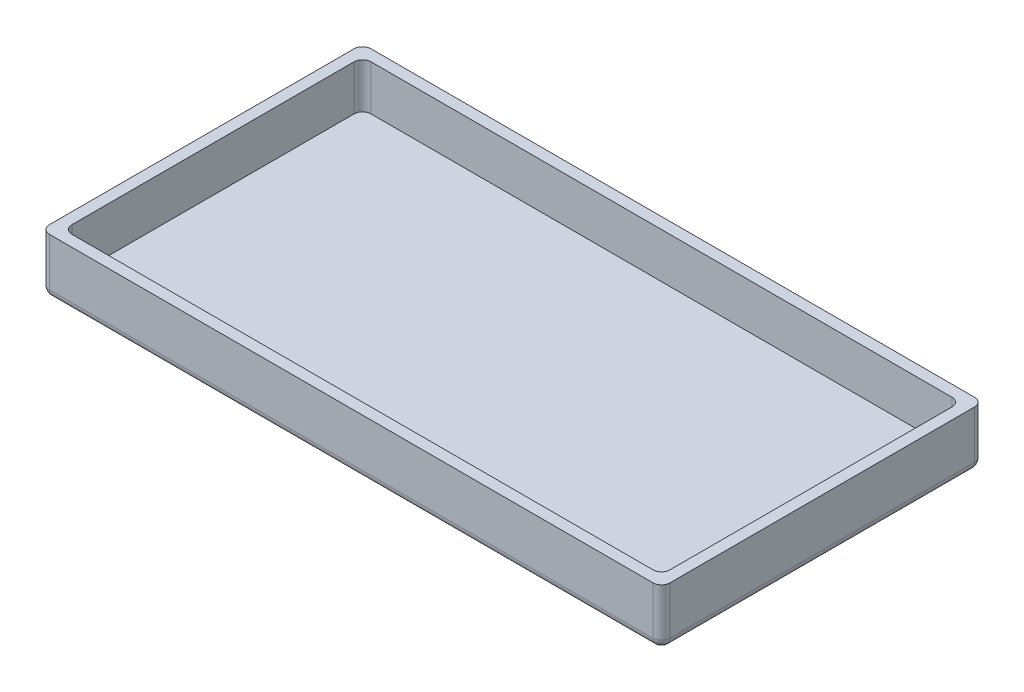
from build123d import *

# Parameters (mm, degrees)
SKETCH1_W           = 110
SKETCH1_H           = 57
SKETCH1_W_2         = 106
SKETCH1_H_2         = 53
EXTRUDE_THIN1_DEPTH = 10
SKETCH2_W           = 110
SKETCH2_H           = 57
BOSS_EXTRUDE1_DEPTH = 2
FILLET1_R           = 1.5
SKETCH4_W           = 0.628205129
SKETCH4_H           = 3.5
SKETCH4_W_2         = 1.211538462
SKETCH4_H_2         = 0.583333334
SKETCH4_W_3         = 0.628205128
CUT_EXTRUDE1_DEPTH  = 0.75


with BuildPart() as part:
    # Sketch1 → Extrude-Thin1 (new body)
    with BuildSketch(Plane(origin=(0, 0, 0), x_dir=(1, 0, 0), z_dir=(0, 1, 0))):
        Rectangle(SKETCH1_W, SKETCH1_H)
        Rectangle(SKETCH1_W_2, SKETCH1_H_2, mode=Mode.SUBTRACT)
    extrude(amount=EXTRUDE_THIN1_DEPTH)

    # Sketch2 → Boss-Extrude1 (add)
    with BuildSketch(Plane(origin=(0, 0, 0), x_dir=(1, 0, 0), z_dir=(0, 1, 0))):
        Rectangle(SKETCH2_W, SKETCH2_H)
    extrude(amount=BOSS_EXTRUDE1_DEPTH)

    # Fillet1
    fillet1_edges = [part.edges().sort_by_distance(p)[0] for p in [
        (53, 6, 26.5),
        (53, 6, -26.5),
        (-53, 6, -26.5),
        (-53, 6, 26.5),
        (0, 0, 28.5),
        (-55, 0, 0),
        (0, 0, -28.5),
        (55, 0, 0),
        (55, 5, 28.5),
        (-55, 5, 28.5),
        (-55, 5, -28.5),
        (55, 5, -28.5),
    ]]
    fillet(fillet1_edges, radius=FILLET1_R)

    # Sketch4 → Cut-Extrude1 (cut)
    # profile 1 of 12: a face of its own
    with BuildSketch(Plane(origin=(0, 0, 0), x_dir=(-1, 0, 0), z_dir=(0, -1, 0))):
        with BuildLine():
            Line((-15.013259857, 0.325934051), (-15.013259857, 3.825934051))
            Line((-15.013259857, 3.825934051), (-14.452362421, 3.825934051))
            add(Edge.make_bspline(
                [(-14.452362421, 3.825934051), (-14.413096093, 3.825938532), (-14.337116494, 3.825947204), (-14.22749776, 3.822097754), (-14.125835643, 3.817118059), (-14.032453669, 3.811546938), (-13.947192897, 3.801946784), (-13.870182979, 3.791829271), (-13.80127005, 3.779628173), (-13.75866493, 3.768683411), (-13.738620434, 3.763534211)],
                knots=[0, 0, 0, 0, 1.311965854, 2.538629056, 3.664479157, 4.713267157, 5.663616078, 6.530575999, 7.308677837, 8, 8, 8, 8], degree=3))
            add(Edge.make_bspline(
                [(-13.738620434, 3.763534211), (-13.712299975, 3.756271174), (-13.660650786, 3.742018763), (-13.586672665, 3.713235404), (-13.516494098, 3.681240659), (-13.450200771, 3.64474064), (-13.388199751, 3.603294687), (-13.330726663, 3.556573875), (-13.276541956, 3.506453574), (-13.227569604, 3.451536945), (-13.183306667, 3.393507355), (-13.14485011, 3.332380007), (-13.111436292, 3.26908958), (-13.084696484, 3.202839605), (-13.064548542, 3.133935181), (-13.049812421, 3.062670541), (-13.040261419, 2.988820186), (-13.039358975, 2.938577376), (-13.038900882, 2.913073474)],
                knots=[0, 0, 0, 0, 1.099996261, 2.158545794, 3.195537121, 4.207578794, 5.205712374, 6.197378256, 7.190519799, 8.17788031, 9.159561366, 10.129234751, 11.085776129, 12.040971148, 13.00380137, 13.975669004, 14.972423361, 16, 16, 16, 16], degree=3))
            add(Edge.make_bspline(
                [(-13.038900882, 2.913073474), (-13.040098658, 2.880307655), (-13.042456333, 2.815812166), (-13.057517317, 2.721079962), (-13.085759009, 2.631544413), (-13.122712576, 2.545555412), (-13.172957874, 2.463433699), (-13.236759684, 2.385218322), (-13.313084628, 2.30850091), (-13.371630073, 2.262513997), (-13.402081972, 2.238594308)],
                knots=[0, 0, 0, 0, 0.986156485, 1.941127874, 2.875419072, 3.804401753, 4.751181392, 5.761612777, 6.835722519, 8, 8, 8, 8], degree=3))
            add(Edge.make_bspline(
                [(-13.402081972, 2.238594308), (-13.377405214, 2.225997036), (-13.329020917, 2.201297273), (-13.260329431, 2.160698234), (-13.196728613, 2.117516008), (-13.137933296, 2.072619438), (-13.08517678, 2.024105292), (-13.036280659, 1.974769024), (-12.993657215, 1.921783869), (-12.955542046, 1.86703832), (-12.922412961, 1.809739655), (-12.893561181, 1.749984638), (-12.869191117, 1.687569133), (-12.848553917, 1.622810784), (-12.833162688, 1.555486853), (-12.823127279, 1.485573263), (-12.815443542, 1.413308454), (-12.81484582, 1.36408347), (-12.814541908, 1.339055045)],
                knots=[0, 0, 0, 0, 1.164658916, 2.283573913, 3.35186032, 4.395461096, 5.390182219, 6.362969632, 7.312859996, 8.245001507, 9.165155236, 10.092416118, 11.032087915, 11.979892451, 12.947605196, 13.931445124, 14.948243989, 16, 16, 16, 16], degree=3))
            add(Edge.make_bspline(
                [(-12.814541908, 1.339055045), (-12.816514092, 1.291252183), (-12.82040619, 1.196913426), (-12.848863311, 1.058402464), (-12.898198916, 0.92708151), (-12.964446461, 0.803472488), (-13.046076182, 0.691153678), (-13.139926952, 0.592763375), (-13.24505391, 0.509478167), (-13.342046235, 0.453267114), (-13.425936958, 0.41554424), (-13.495422076, 0.392221581), (-13.57004762, 0.370615504), (-13.651180551, 0.355443272), (-13.737350039, 0.341555976), (-13.829396242, 0.332981672), (-13.927147128, 0.327171077), (-13.994286662, 0.326354729), (-14.028884857, 0.325934051)],
                knots=[0, 0, 0, 0, 1.284142165, 2.534249414, 3.780121997, 5.041676246, 6.291546858, 7.49970053, 8.684500223, 9.883330709, 10.50184324, 11.153274765, 11.851151195, 12.587658647, 13.369265475, 14.195992086, 15.070362669, 16, 16, 16, 16], degree=3))
            Line((-14.028884857, 0.325934051), (-15.013259857, 0.325934051))
        make_face()
        with BuildLine():
            Line((-14.385054729, 3.197728923), (-14.385054729, 2.43490841))
            Line((-14.385054729, 2.43490841), (-14.218187741, 2.43490841))
            add(Edge.make_bspline(
                [(-14.218187741, 2.43490841), (-14.195509019, 2.435106177), (-14.151729117, 2.435487954), (-14.088493692, 2.440405114), (-14.02969496, 2.448794093), (-13.97555593, 2.460498829), (-13.925572278, 2.475362137), (-13.880063315, 2.493245897), (-13.839229134, 2.515066029), (-13.79178926, 2.547568079), (-13.741641892, 2.595396299), (-13.697497728, 2.664494074), (-13.67149711, 2.743956251), (-13.668601343, 2.799999132), (-13.667106011, 2.828938859)],
                knots=[0, 0, 0, 0, 1.065314748, 2.056525647, 2.977365736, 3.853934255, 4.656397591, 5.425096493, 6.14721249, 6.826394842, 8.123232004, 9.372140726, 10.643011755, 12, 12, 12, 12], degree=3))
            add(Edge.make_bspline(
                [(-13.667106011, 2.828938859), (-13.66830255, 2.856045721), (-13.670616011, 2.908455751), (-13.69679529, 2.9820441), (-13.737456886, 3.047258438), (-13.785463616, 3.09189232), (-13.83067128, 3.122375945), (-13.869380856, 3.142448114), (-13.911867522, 3.160416514), (-13.958953776, 3.174155591), (-14.010370728, 3.184464911), (-14.065868617, 3.192035871), (-14.125543197, 3.197188989), (-14.166760556, 3.197545084), (-14.188039504, 3.197728923)],
                knots=[0, 0, 0, 0, 1.347982417, 2.606269829, 3.849316587, 5.153353503, 5.842674298, 6.568177932, 7.326619318, 8.142485038, 9.012069166, 9.942760135, 10.937925643, 12, 12, 12, 12], degree=3))
            Line((-14.188039504, 3.197728923), (-14.385054729, 3.197728923))
        make_face(mode=Mode.SUBTRACT)
        with BuildLine():
            Line((-14.385054729, 1.851575077), (-14.385054729, 0.954139179))
            Line((-14.385054729, 0.954139179), (-14.204165306, 0.954139179))
            add(Edge.make_bspline(
                [(-14.204165306, 0.954139179), (-14.168403236, 0.954343487), (-14.099646196, 0.954736293), (-14.001151857, 0.959482329), (-13.911595879, 0.968036222), (-13.831215552, 0.978715068), (-13.759887758, 0.993183235), (-13.697853603, 1.011577654), (-13.644262367, 1.03181472), (-13.599435387, 1.056809898), (-13.562814313, 1.085898088), (-13.529767633, 1.115626916), (-13.502823429, 1.149921928), (-13.481504672, 1.187310935), (-13.463053326, 1.226865165), (-13.451924776, 1.270129198), (-13.44345189, 1.315820791), (-13.442985604, 1.347424678), (-13.442747036, 1.363594308)],
                knots=[0, 0, 0, 0, 1.753078804, 3.370512758, 4.83203934, 6.162291463, 7.344201807, 8.395507345, 9.331626367, 10.147333109, 10.898971645, 11.62040215, 12.321813352, 13.025280112, 13.727906689, 14.453419512, 15.208716525, 16, 16, 16, 16], degree=3))
            add(Edge.make_bspline(
                [(-13.442747036, 1.363594308), (-13.443273147, 1.382084533), (-13.444297868, 1.418098519), (-13.452666778, 1.470736802), (-13.467875821, 1.519878132), (-13.487032353, 1.566779119), (-13.513689685, 1.609760544), (-13.545371014, 1.650309831), (-13.583650146, 1.687053856), (-13.626697264, 1.722215036), (-13.676907465, 1.753000554), (-13.734304306, 1.779712443), (-13.799199598, 1.80202123), (-13.871794362, 1.8197835), (-13.951770347, 1.834858094), (-14.03971129, 1.84385929), (-14.134884789, 1.850553875), (-14.200879642, 1.851226942), (-14.235014665, 1.851575077)],
                knots=[0, 0, 0, 0, 0.845221588, 1.646264278, 2.427170338, 3.19324141, 3.95557735, 4.731569926, 5.540061037, 6.376114724, 7.268642756, 8.224665384, 9.265483498, 10.400594375, 11.639216012, 12.983232105, 14.439614077, 16, 16, 16, 16], degree=3))
            Line((-14.235014665, 1.851575077), (-14.385054729, 1.851575077))
        make_face(mode=Mode.SUBTRACT)
    # profile 2 of 12: a face of its own
    with BuildSketch(Plane(origin=(0, 0, 0), x_dir=(-1, 0, 0), z_dir=(0, -1, 0))):
        with Locations((-11.961977806, 2.075934051)):
            Rectangle(SKETCH4_W, SKETCH4_H)
    # profile 3 of 12: a face of its own
    with BuildSketch(Plane(origin=(0, 0, 0), x_dir=(-1, 0, 0), z_dir=(0, -1, 0))):
        with BuildLine():
            Line((-7.699157293, 3.218762577), (-8.159794312, 2.77845809))
            add(Edge.make_bspline(
                [(-8.159794312, 2.77845809), (-8.198869297, 2.818861689), (-8.275194984, 2.897782577), (-8.398184388, 3.002266878), (-8.526088892, 3.089340406), (-8.656420366, 3.162673176), (-8.791523097, 3.218154644), (-8.929834929, 3.258584923), (-9.072239025, 3.283233737), (-9.168612639, 3.286053997), (-9.217085979, 3.287472513)],
                knots=[0, 0, 0, 0, 1.115251505, 2.178435587, 3.19620269, 4.182487026, 5.141301733, 6.088180966, 7.038406374, 8, 8, 8, 8], degree=3))
            add(Edge.make_bspline(
                [(-9.217085979, 3.287472513), (-9.257567108, 3.286351836), (-9.337452156, 3.284140304), (-9.454744341, 3.267927594), (-9.566940378, 3.240357175), (-9.674424331, 3.20236003), (-9.776879925, 3.153193741), (-9.87452197, 3.092896362), (-9.967109734, 3.022012464), (-10.053420185, 2.940908803), (-10.132373954, 2.852296959), (-10.202134635, 2.757748332), (-10.260570396, 2.657479529), (-10.308527675, 2.552505998), (-10.345884541, 2.442341869), (-10.372562037, 2.327061311), (-10.387991587, 2.206527031), (-10.390294551, 2.124588726), (-10.391464985, 2.082945269)],
                knots=[0, 0, 0, 0, 1.035432265, 2.043311493, 3.022114605, 3.98653278, 4.95457646, 5.923598177, 6.917315552, 7.932509744, 8.948865224, 9.949768934, 10.933144597, 11.912367597, 12.897413939, 13.903909035, 14.934704909, 16, 16, 16, 16], degree=3))
            add(Edge.make_bspline(
                [(-10.391464985, 2.082945269), (-10.391127679, 2.053716977), (-10.390462843, 1.996107413), (-10.383185031, 1.91088688), (-10.371466039, 1.828202815), (-10.354505754, 1.748180463), (-10.33329675, 1.670750477), (-10.30841376, 1.595244871), (-10.277198414, 1.522706963), (-10.24254891, 1.452294273), (-10.202251936, 1.385928098), (-10.158804363, 1.322642442), (-10.111692565, 1.262747526), (-10.060611394, 1.206488201), (-10.004841947, 1.154743675), (-9.945825658, 1.105957928), (-9.882567004, 1.061352233), (-9.816380026, 1.019807161), (-9.746692955, 0.983716603), (-9.67539656, 0.95102553), (-9.601409845, 0.924475518), (-9.525633643, 0.903073786), (-9.448338751, 0.88487481), (-9.368769154, 0.873669141), (-9.28761462, 0.865183219), (-9.232767777, 0.864659263), (-9.205166908, 0.86439559)],
                knots=[0, 0, 0, 0, 1.103660481, 2.175337485, 3.227646561, 4.255952547, 5.262355991, 6.258840057, 7.255597736, 8.242457506, 9.22035537, 10.185017736, 11.140346927, 12.096287581, 13.051739095, 14.01125915, 14.986044842, 15.97314143, 16.960198552, 17.947847494, 18.933482797, 19.925264591, 20.920966487, 21.929612487, 22.958107872, 24, 24, 24, 24], degree=3))
            add(Edge.make_bspline(
                [(-9.205166908, 0.86439559), (-9.158351091, 0.865749751), (-9.066370185, 0.868410327), (-8.931374979, 0.889215654), (-8.802737997, 0.92343924), (-8.699957664, 0.963855306), (-8.619431987, 1.003766696), (-8.55812898, 1.040682766), (-8.494736893, 1.081977444), (-8.430308614, 1.129209235), (-8.364119453, 1.181811338), (-8.297337801, 1.240935839), (-8.228254037, 1.304635853), (-8.182997947, 1.350099803), (-8.159794312, 1.373410013)],
                knots=[0, 0, 0, 0, 1.404581149, 2.759636711, 4.088442092, 5.392261763, 6.066678138, 6.783632037, 7.538459478, 8.336747902, 9.180226004, 10.074962426, 11.012997595, 12, 12, 12, 12], degree=3))
            Line((-8.159794312, 1.373410013), (-7.713179729, 0.904359532))
            add(Edge.make_bspline(
                [(-7.713179729, 0.904359532), (-7.74457433, 0.87404903), (-7.805849878, 0.814889412), (-7.89828234, 0.730888276), (-7.990598473, 0.655403916), (-8.08056811, 0.585696583), (-8.169665049, 0.52379702), (-8.25787984, 0.469643406), (-8.344213854, 0.421866119), (-8.430459843, 0.3812709), (-8.517154476, 0.346801342), (-8.606353065, 0.317125316), (-8.698328299, 0.292020465), (-8.793641921, 0.271764147), (-8.891404902, 0.255521315), (-8.992532176, 0.244557498), (-9.096382544, 0.237186888), (-9.166825858, 0.236524577), (-9.202362421, 0.236190461)],
                knots=[0, 0, 0, 0, 1.244526981, 2.429050516, 3.560637417, 4.644440555, 5.67424972, 6.652764056, 7.595344123, 8.486817594, 9.369275933, 10.254498637, 11.166417451, 12.086725134, 13.032340136, 13.991389299, 14.986715468, 16, 16, 16, 16], degree=3))
            add(Edge.make_bspline(
                [(-9.202362421, 0.236190461), (-9.267638685, 0.237854484), (-9.395366189, 0.241110512), (-9.582547515, 0.265235481), (-9.760364751, 0.305680567), (-9.929250492, 0.362881073), (-10.089151036, 0.435952039), (-10.240025477, 0.525533612), (-10.381630637, 0.631387788), (-10.512822626, 0.752273854), (-10.631492024, 0.885782365), (-10.736382029, 1.029133879), (-10.823147045, 1.183032917), (-10.895189907, 1.345205897), (-10.951526478, 1.516392879), (-10.991177874, 1.696779034), (-11.0156306, 1.886190188), (-11.018305763, 2.015562372), (-11.019670113, 2.081543025)],
                knots=[0, 0, 0, 0, 1.078019885, 2.10938526, 3.111377082, 4.085535484, 5.04941344, 6.010039228, 6.978205633, 7.964457913, 8.951525778, 9.924444315, 10.892603023, 11.863865945, 12.85144698, 13.863884204, 14.910567087, 16, 16, 16, 16], degree=3))
            add(Edge.make_bspline(
                [(-11.019670113, 2.081543025), (-11.019093605, 2.124575045), (-11.017951106, 2.209853989), (-11.005943339, 2.335476784), (-10.989203813, 2.457936538), (-10.962648077, 2.575961714), (-10.930637757, 2.691142328), (-10.890828718, 2.802226502), (-10.843284541, 2.909533503), (-10.789537686, 3.013242968), (-10.728734408, 3.112675491), (-10.66081047, 3.206976789), (-10.587514501, 3.29687485), (-10.507085318, 3.38117701), (-10.420691662, 3.460623458), (-10.327943476, 3.534783659), (-10.229398594, 3.604721154), (-10.12479029, 3.668632424), (-10.016150827, 3.726443565), (-9.904850433, 3.777435461), (-9.791162561, 3.820052943), (-9.675567893, 3.855402572), (-9.557578043, 3.88178857), (-9.438035193, 3.90176192), (-9.315922177, 3.91292715), (-9.233933865, 3.91475497), (-9.192546716, 3.915677641)],
                knots=[0, 0, 0, 0, 1.071919942, 2.124283339, 3.142214191, 4.149696895, 5.136002878, 6.119640489, 7.086990633, 8.058538607, 9.028339693, 9.988281803, 10.952401235, 11.916291999, 12.888973767, 13.874849856, 14.873389453, 15.898127285, 16.927174885, 17.938320013, 18.946391617, 19.950418109, 20.947802303, 21.956882652, 22.968648068, 24, 24, 24, 24], degree=3))
            add(Edge.make_bspline(
                [(-9.192546716, 3.915677641), (-9.157239234, 3.915148743), (-9.086991369, 3.914096446), (-8.98238051, 3.905324405), (-8.878606279, 3.891548004), (-8.776040221, 3.870762349), (-8.673948678, 3.84608715), (-8.573673247, 3.81377838), (-8.47363203, 3.777764168), (-8.375394023, 3.73471653), (-8.278822101, 3.687726146), (-8.186178614, 3.634413848), (-8.095908086, 3.578060416), (-8.010010858, 3.515330607), (-7.926877889, 3.448499748), (-7.84694389, 3.377256036), (-7.770910327, 3.300411627), (-7.723195885, 3.246116517), (-7.699157293, 3.218762577)],
                knots=[0, 0, 0, 0, 0.996412454, 1.982464992, 2.961075852, 3.949442424, 4.934965278, 5.923860011, 6.921385422, 7.934793307, 8.949617135, 9.951082467, 10.950285876, 11.951772932, 12.951063433, 13.960125323, 14.972308753, 16, 16, 16, 16], degree=3))
        make_face()
    # profile 4 of 12: a face of its own
    with BuildSketch(Plane(origin=(0, 0, 0), x_dir=(-1, 0, 0), z_dir=(0, -1, 0))):
        Polygon((-7.362618831, 3.825934051), (-6.663600402, 3.825934051), (-6.038900882, 2.598269788), (-5.414201363, 3.825934051), (-4.715182934, 3.825934051), (-5.724798318, 1.841759372), (-5.724798318, 0.325934051), (-6.353003447, 0.325934051), (-6.353003447, 1.841759372), align=None)
    # profile 5 of 12: a face of its own
    with BuildSketch(Plane(origin=(0, 0, 0), x_dir=(-1, 0, 0), z_dir=(0, -1, 0))):
        with BuildLine():
            Line((-0.923516267, 3.218762577), (-1.384153286, 2.77845809))
            add(Edge.make_bspline(
                [(-1.384153286, 2.77845809), (-1.423228271, 2.818861689), (-1.499553958, 2.897782577), (-1.622543363, 3.002266878), (-1.750447866, 3.089340406), (-1.88077934, 3.162673176), (-2.015882071, 3.218154644), (-2.154193904, 3.258584923), (-2.296597999, 3.283233737), (-2.392971613, 3.286053997), (-2.441444953, 3.287472513)],
                knots=[0, 0, 0, 0, 1.115251505, 2.178435587, 3.19620269, 4.182487026, 5.141301733, 6.088180966, 7.038406374, 8, 8, 8, 8], degree=3))
            add(Edge.make_bspline(
                [(-2.441444953, 3.287472513), (-2.481926082, 3.286351836), (-2.561811131, 3.284140304), (-2.679103316, 3.267927594), (-2.791299352, 3.240357175), (-2.898783306, 3.20236003), (-3.001238899, 3.153193741), (-3.098880944, 3.092896362), (-3.191468708, 3.022012464), (-3.27777916, 2.940908803), (-3.356732928, 2.852296959), (-3.426493609, 2.757748332), (-3.48492937, 2.657479529), (-3.532886649, 2.552505998), (-3.570243515, 2.442341869), (-3.596921011, 2.327061311), (-3.612350562, 2.206527031), (-3.614653525, 2.124588726), (-3.615823959, 2.082945269)],
                knots=[0, 0, 0, 0, 1.035432265, 2.043311493, 3.022114605, 3.98653278, 4.95457646, 5.923598177, 6.917315552, 7.932509744, 8.948865224, 9.949768934, 10.933144597, 11.912367597, 12.897413939, 13.903909035, 14.934704909, 16, 16, 16, 16], degree=3))
            add(Edge.make_bspline(
                [(-3.615823959, 2.082945269), (-3.615486654, 2.053716977), (-3.614821817, 1.996107413), (-3.607544006, 1.91088688), (-3.595825014, 1.828202815), (-3.578864728, 1.748180463), (-3.557655725, 1.670750477), (-3.532772734, 1.595244871), (-3.501557389, 1.522706963), (-3.466907884, 1.452294273), (-3.42661091, 1.385928098), (-3.383163338, 1.322642442), (-3.336051539, 1.262747526), (-3.284970369, 1.206488201), (-3.229200922, 1.154743675), (-3.170184633, 1.105957928), (-3.106925978, 1.061352233), (-3.040739001, 1.019807161), (-2.971051929, 0.983716603), (-2.899755534, 0.95102553), (-2.825768819, 0.924475518), (-2.749992617, 0.903073786), (-2.672697726, 0.88487481), (-2.593128129, 0.873669141), (-2.511973595, 0.865183219), (-2.457126751, 0.864659263), (-2.429525882, 0.86439559)],
                knots=[0, 0, 0, 0, 1.103660481, 2.175337485, 3.227646561, 4.255952547, 5.262355991, 6.258840057, 7.255597736, 8.242457506, 9.22035537, 10.185017736, 11.140346927, 12.096287581, 13.051739095, 14.01125915, 14.986044842, 15.97314143, 16.960198552, 17.947847494, 18.933482797, 19.925264591, 20.920966487, 21.929612487, 22.958107872, 24, 24, 24, 24], degree=3))
            add(Edge.make_bspline(
                [(-2.429525882, 0.86439559), (-2.382710066, 0.865749751), (-2.290729159, 0.868410327), (-2.155733953, 0.889215654), (-2.027096971, 0.92343924), (-1.924316638, 0.963855306), (-1.843790962, 1.003766696), (-1.782487955, 1.040682766), (-1.719095868, 1.081977444), (-1.654667589, 1.129209235), (-1.588478428, 1.181811338), (-1.521696776, 1.240935839), (-1.452613011, 1.304635853), (-1.407356921, 1.350099803), (-1.384153286, 1.373410013)],
                knots=[0, 0, 0, 0, 1.404581149, 2.759636711, 4.088442092, 5.392261763, 6.066678138, 6.783632037, 7.538459478, 8.336747902, 9.180226004, 10.074962426, 11.012997595, 12, 12, 12, 12], degree=3))
            Line((-1.384153286, 1.373410013), (-0.937538703, 0.904359532))
            add(Edge.make_bspline(
                [(-0.937538703, 0.904359532), (-0.968933304, 0.87404903), (-1.030208852, 0.814889412), (-1.122641315, 0.730888276), (-1.214957447, 0.655403916), (-1.304927085, 0.585696583), (-1.394024023, 0.52379702), (-1.482238814, 0.469643406), (-1.568572828, 0.421866119), (-1.654818818, 0.3812709), (-1.741513451, 0.346801342), (-1.83071204, 0.317125316), (-1.922687274, 0.292020465), (-2.018000895, 0.271764147), (-2.115763877, 0.255521315), (-2.21689115, 0.244557498), (-2.320741519, 0.237186888), (-2.391184832, 0.236524577), (-2.426721395, 0.236190461)],
                knots=[0, 0, 0, 0, 1.244526981, 2.429050516, 3.560637417, 4.644440555, 5.67424972, 6.652764056, 7.595344123, 8.486817594, 9.369275933, 10.254498637, 11.166417451, 12.086725134, 13.032340136, 13.991389299, 14.986715468, 16, 16, 16, 16], degree=3))
            add(Edge.make_bspline(
                [(-2.426721395, 0.236190461), (-2.491997659, 0.237854484), (-2.619725163, 0.241110512), (-2.80690649, 0.265235481), (-2.984723726, 0.305680567), (-3.153609466, 0.362881073), (-3.313510011, 0.435952039), (-3.464384451, 0.525533612), (-3.605989611, 0.631387788), (-3.7371816, 0.752273854), (-3.855850998, 0.885782365), (-3.960741003, 1.029133879), (-4.047506019, 1.183032917), (-4.119548882, 1.345205897), (-4.175885453, 1.516392879), (-4.215536848, 1.696779034), (-4.239989574, 1.886190188), (-4.242664737, 2.015562372), (-4.244029088, 2.081543025)],
                knots=[0, 0, 0, 0, 1.078019885, 2.10938526, 3.111377082, 4.085535484, 5.04941344, 6.010039228, 6.978205633, 7.964457913, 8.951525778, 9.924444315, 10.892603023, 11.863865945, 12.85144698, 13.863884204, 14.910567087, 16, 16, 16, 16], degree=3))
            add(Edge.make_bspline(
                [(-4.244029088, 2.081543025), (-4.243452579, 2.124575045), (-4.24231008, 2.209853989), (-4.230302313, 2.335476784), (-4.213562787, 2.457936538), (-4.187007051, 2.575961714), (-4.154996731, 2.691142328), (-4.115187692, 2.802226502), (-4.067643515, 2.909533503), (-4.013896661, 3.013242968), (-3.953093382, 3.112675491), (-3.885169445, 3.206976789), (-3.811873476, 3.29687485), (-3.731444293, 3.38117701), (-3.645050637, 3.460623458), (-3.55230245, 3.534783659), (-3.453757568, 3.604721154), (-3.349149265, 3.668632424), (-3.240509801, 3.726443565), (-3.129209408, 3.777435461), (-3.015521535, 3.820052943), (-2.899926867, 3.855402572), (-2.781937018, 3.88178857), (-2.662394168, 3.90176192), (-2.540281151, 3.91292715), (-2.45829284, 3.91475497), (-2.41690569, 3.915677641)],
                knots=[0, 0, 0, 0, 1.071919942, 2.124283339, 3.142214191, 4.149696895, 5.136002878, 6.119640489, 7.086990633, 8.058538607, 9.028339693, 9.988281803, 10.952401235, 11.916291999, 12.888973767, 13.874849856, 14.873389453, 15.898127285, 16.927174885, 17.938320013, 18.946391617, 19.950418109, 20.947802303, 21.956882652, 22.968648068, 24, 24, 24, 24], degree=3))
            add(Edge.make_bspline(
                [(-2.41690569, 3.915677641), (-2.381598208, 3.915148743), (-2.311350343, 3.914096446), (-2.206739484, 3.905324405), (-2.102965254, 3.891548004), (-2.000399196, 3.870762349), (-1.898307653, 3.84608715), (-1.798032222, 3.81377838), (-1.697991004, 3.777764168), (-1.599752997, 3.73471653), (-1.503181076, 3.687726146), (-1.410537589, 3.634413848), (-1.320267061, 3.578060416), (-1.234369832, 3.515330607), (-1.151236864, 3.448499748), (-1.071302864, 3.377256036), (-0.995269301, 3.300411627), (-0.947554859, 3.246116517), (-0.923516267, 3.218762577)],
                knots=[0, 0, 0, 0, 0.996412454, 1.982464992, 2.961075852, 3.949442424, 4.934965278, 5.923860011, 6.921385422, 7.934793307, 8.949617135, 9.951082467, 10.950285876, 11.951772932, 12.951063433, 13.960125323, 14.972308753, 16, 16, 16, 16], degree=3))
        make_face()
    # profile 6 of 12: a face of its own
    with BuildSketch(Plane(origin=(0, 0, 0), x_dir=(-1, 0, 0), z_dir=(0, -1, 0))):
        Polygon((-0.295311139, 3.825934051), (0.332893989, 3.825934051), (0.332893989, 0.954139179), (1.320073477, 0.954139179), (1.320073477, 0.325934051), (-0.295311139, 0.325934051), align=None)
    # profile 7 of 12: a face of its own
    with BuildSketch(Plane(origin=(0, 0, 0), x_dir=(-1, 0, 0), z_dir=(0, -1, 0))):
        Polygon((1.858535015, 3.825934051), (3.7431504, 3.825934051), (3.7431504, 3.197728923), (2.486740143, 3.197728923), (2.486740143, 2.524652), (3.7431504, 2.524652), (3.7431504, 1.896446872), (2.486740143, 1.896446872), (2.486740143, 0.954139179), (3.7431504, 0.954139179), (3.7431504, 0.325934051), (1.858535015, 0.325934051), align=None)
    # profile 8 of 12: a face of its own
    with BuildSketch(Plane(origin=(0, 0, 0), x_dir=(-1, 0, 0), z_dir=(0, -1, 0))):
        with BuildLine():
            Line((8.183354727, 1.447728923), (6.166227323, 1.447728923))
            add(Edge.make_bspline(
                [(6.166227323, 1.447728923), (6.170340083, 1.424291047), (6.17842198, 1.378233771), (6.195972108, 1.311331582), (6.218368704, 1.248284088), (6.245209613, 1.18900701), (6.276042299, 1.133186974), (6.312006073, 1.081085797), (6.352644766, 1.032749499), (6.397723417, 0.988388154), (6.446490647, 0.948639428), (6.498709953, 0.913817031), (6.554435222, 0.885264796), (6.613027584, 0.861198224), (6.674924859, 0.842135061), (6.740218144, 0.828987561), (6.808734358, 0.821221284), (6.855409695, 0.820097981), (6.879268188, 0.819523795)],
                knots=[0, 0, 0, 0, 1.091296461, 2.144483647, 3.168565212, 4.157007626, 5.126487748, 6.090021542, 7.05641414, 8.019231907, 8.98705074, 9.938580405, 10.892824166, 11.854447369, 12.841318655, 13.858982407, 14.905600794, 16, 16, 16, 16], degree=3))
            add(Edge.make_bspline(
                [(6.879268188, 0.819523795), (6.908067008, 0.820284111), (6.964780367, 0.821781399), (7.047865859, 0.835060115), (7.128221632, 0.855117031), (7.205087239, 0.88494335), (7.279353045, 0.922071873), (7.349796409, 0.968329444), (7.417636649, 1.022364267), (7.45902719, 1.064014287), (7.480129566, 1.085248955)],
                knots=[0, 0, 0, 0, 1.021034703, 2.010718019, 2.977989445, 3.954245119, 4.929443971, 5.918328161, 6.938689359, 8, 8, 8, 8], degree=3))
            Line((7.480129566, 1.085248955), (8.005970912, 0.834948474))
            add(Edge.make_bspline(
                [(8.005970912, 0.834948474), (7.989415105, 0.812070889), (7.95661038, 0.766739794), (7.903057768, 0.702947237), (7.847172208, 0.643426192), (7.788912019, 0.588568141), (7.728203314, 0.538529405), (7.66521497, 0.492700423), (7.599026437, 0.452311686), (7.530961143, 0.415409208), (7.459612053, 0.383772886), (7.385176622, 0.356794547), (7.307970124, 0.332406358), (7.227017609, 0.313823894), (7.142993168, 0.299114167), (7.055695797, 0.288668313), (6.965137003, 0.282216409), (6.903584717, 0.281451543), (6.87225697, 0.281062256)],
                knots=[0, 0, 0, 0, 1.028154879, 2.037251081, 3.030720504, 4.000128189, 4.949298328, 5.894184978, 6.834267904, 7.770992897, 8.712077017, 9.673380525, 10.653304757, 11.658697181, 12.695551717, 13.758623199, 14.859225354, 16, 16, 16, 16], degree=3))
            add(Edge.make_bspline(
                [(6.87225697, 0.281062256), (6.824059745, 0.282044853), (6.729668258, 0.283969211), (6.591603645, 0.301830012), (6.460480556, 0.331445144), (6.335928745, 0.371702368), (6.218486609, 0.424854515), (6.108096025, 0.489864), (6.003654032, 0.565484461), (5.908351918, 0.653302971), (5.821528881, 0.748888198), (5.745268923, 0.851540204), (5.681455676, 0.960541799), (5.629050954, 1.075171588), (5.588320184, 1.195722977), (5.558955661, 1.322248573), (5.540954857, 1.454687946), (5.53901068, 1.544893942), (5.538022194, 1.590757769)],
                knots=[0, 0, 0, 0, 1.103565453, 2.161269334, 3.182010356, 4.179077853, 5.15417608, 6.128274628, 7.109042802, 8.101804412, 9.090965879, 10.063106201, 11.02526161, 11.978650795, 12.945248442, 13.93468508, 14.949922959, 16, 16, 16, 16], degree=3))
            add(Edge.make_bspline(
                [(5.538022194, 1.590757769), (5.539020409, 1.637787055), (5.540984352, 1.730315062), (5.558800674, 1.86581252), (5.588401367, 1.995095422), (5.629251283, 2.118341803), (5.680861019, 2.235937127), (5.74548618, 2.346852574), (5.821491037, 2.451474292), (5.908001296, 2.54931285), (6.00370714, 2.637622837), (6.10540364, 2.716324684), (6.214233462, 2.781904287), (6.328965647, 2.834892566), (6.448866326, 2.877944204), (6.575321384, 2.906591475), (6.70736869, 2.925826402), (6.79763332, 2.927597818), (6.843510977, 2.928498154)],
                knots=[0, 0, 0, 0, 1.079208495, 2.12329425, 3.130605359, 4.119693003, 5.099659317, 6.073216462, 7.060498243, 8.06384408, 9.066070512, 10.045757761, 11.010926815, 11.975797609, 12.942977511, 13.929384301, 14.947594487, 16, 16, 16, 16], degree=3))
            add(Edge.make_bspline(
                [(6.843510977, 2.928498154), (6.891939099, 2.927500313), (6.987022726, 2.925541156), (7.126048917, 2.907825381), (7.258042647, 2.878029659), (7.383566285, 2.838120532), (7.501016841, 2.783625706), (7.61297506, 2.720216001), (7.71675555, 2.642960946), (7.8134645, 2.555572192), (7.900764092, 2.458617398), (7.977073608, 2.353294796), (8.042003614, 2.240632274), (8.094630029, 2.120172961), (8.135318976, 1.992278487), (8.164710681, 1.857114949), (8.182574182, 1.714168249), (8.184482182, 1.61628445), (8.185458092, 1.566218506)],
                knots=[0, 0, 0, 0, 1.080001299, 2.120471247, 3.119684163, 4.095710327, 5.052285597, 6.002875087, 6.961153713, 7.931888285, 8.906493152, 9.865905668, 10.82813294, 11.801621613, 12.7925306, 13.817193356, 14.883530496, 16, 16, 16, 16], degree=3))
            Line((8.185458092, 1.566218506), (8.183354727, 1.447728923))
        make_face()
        with BuildLine():
            add(Edge.make_bspline(
                [(7.557252964, 1.941318667), (7.545398349, 1.97330947), (7.521828286, 2.036915522), (7.468584495, 2.124676353), (7.397931688, 2.200680797), (7.315757405, 2.267968134), (7.221868142, 2.32258274), (7.119222513, 2.362125488), (7.009117939, 2.385835816), (6.933371925, 2.388616621), (6.894692868, 2.390036615)],
                knots=[0, 0, 0, 0, 0.954238005, 1.897273737, 2.851915805, 3.847685534, 4.862635127, 5.880135777, 6.917509367, 8, 8, 8, 8], degree=3))
            add(Edge.make_bspline(
                [(6.894692868, 2.390036615), (6.852449039, 2.388672538), (6.769871151, 2.38600605), (6.650758169, 2.357646977), (6.538401874, 2.315321908), (6.47216297, 2.271683863), (6.438963701, 2.249812256)],
                knots=[0, 0, 0, 0, 1.044195649, 2.041185066, 3.018232172, 4, 4, 4, 4], degree=3))
            add(Edge.make_bspline(
                [(6.438963701, 2.249812256), (6.418249836, 2.233154362), (6.374088936, 2.197640583), (6.316737048, 2.126793965), (6.26024496, 2.041014614), (6.228126094, 1.975859137), (6.211099118, 1.941318667)],
                knots=[0, 0, 0, 0, 0.82159062, 1.751589201, 2.808063854, 4, 4, 4, 4], degree=3))
            Line((6.211099118, 1.941318667), (7.557252964, 1.941318667))
        make_face(mode=Mode.SUBTRACT)
    # profile 9 of 12: a face of its own
    with BuildSketch(Plane(origin=(0, 0, 0), x_dir=(-1, 0, 0), z_dir=(0, -1, 0))):
        with Locations((9.419432451, 1.604780205)):
            Rectangle(SKETCH4_W_2, SKETCH4_H_2)
    # profile 10 of 12: a face of its own
    with BuildSketch(Plane(origin=(0, 0, 0), x_dir=(-1, 0, 0), z_dir=(0, -1, 0))):
        Polygon((10.832893989, 3.825934051), (11.461099118, 3.825934051), (11.461099118, 2.594063058), (12.453887579, 3.825934051), (13.246856329, 3.825934051), (11.999560656, 2.277857128), (13.3681504, 0.325934051), (12.611639983, 0.325934051), (11.461099118, 1.967260173), (11.461099118, 0.325934051), (10.832893989, 0.325934051), align=None)
    # profile 11 of 12: a face of its own
    with BuildSketch(Plane(origin=(0, 0, 0), x_dir=(-1, 0, 0), z_dir=(0, -1, 0))):
        with Locations((14.06366322, 2.075934051)):
            Rectangle(SKETCH4_W_3, SKETCH4_H)
    # profile 12 of 12: a face of its own
    with BuildSketch(Plane(origin=(0, 0, 0), x_dir=(-1, 0, 0), z_dir=(0, -1, 0))):
        Polygon((14.826483733, 3.825934051), (16.711099118, 3.825934051), (16.711099118, 3.197728923), (16.082893989, 3.197728923), (16.082893989, 0.325934051), (15.454688861, 0.325934051), (15.454688861, 3.197728923), (14.826483733, 3.197728923), align=None)
    extrude(amount=-CUT_EXTRUDE1_DEPTH, mode=Mode.SUBTRACT)


solid = part.part
